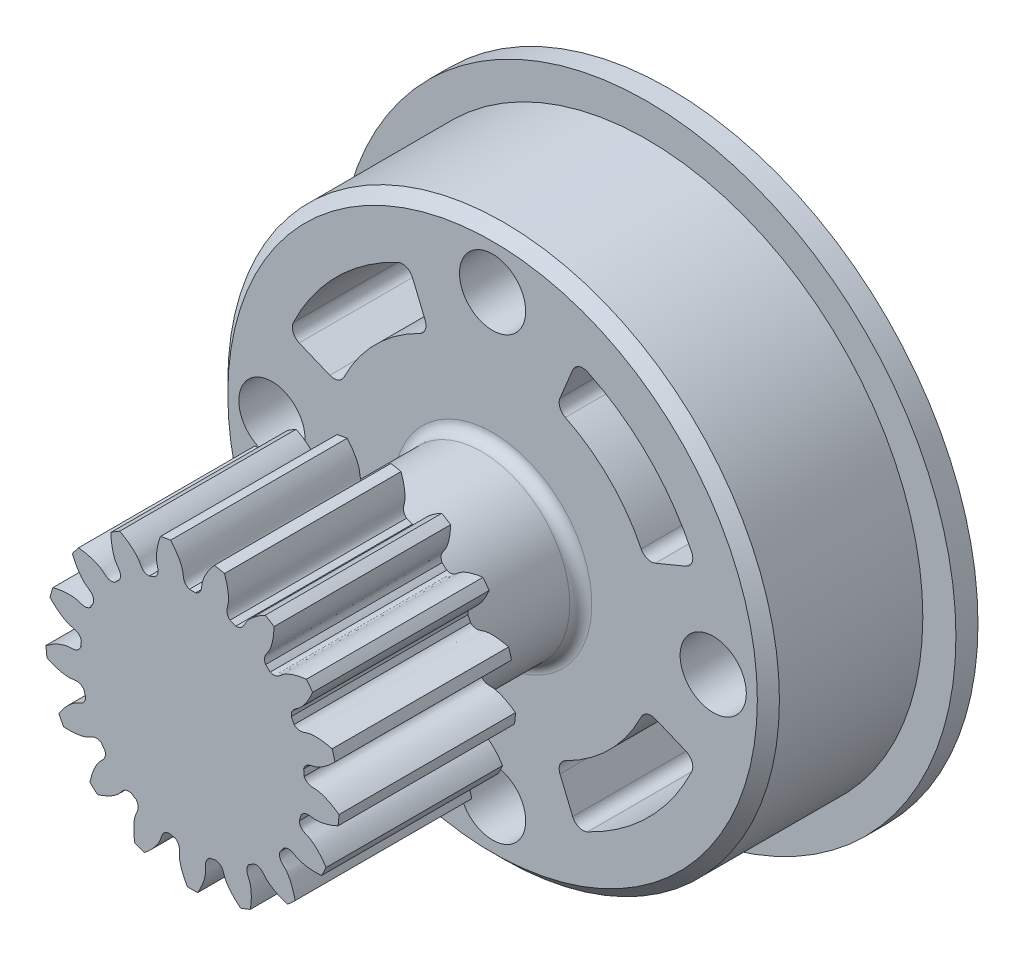
from build123d import *

# Parameters (mm, degrees)
SKETCH_1_R               = 6.65
EXTRUDE_1_DEPTH          = 8
CUT_EXTRUDE_1_DEPTH      = 13.346861949
PATTERN_CIRCULAR_1_COUNT = 17
SKETCH_6_R               = 1.5
CUT_EXTRUDE_2_DEPTH      = 25.019994448
SKETCH_7_R               = 3
CUT_EXTRUDE_3_DEPTH      = 2.5
CHAMFER_1_SIZE           = 0.5
FILLET_1_R               = 0.5
CUT_EXTRUDE_4_DEPTH      = 25.019994448
FILLET_2_R               = 0.5


with BuildPart() as part:
    # 草图1 → 凸台-拉伸1 (new body)
    with BuildSketch(Plane.XY):
        Circle(SKETCH_1_R)
    extrude(amount=EXTRUDE_1_DEPTH)

    # 草图2 → 切除-拉伸1 (cut, through all)
    with BuildSketch(Plane.XY):
        with BuildLine():
            ThreePointArc((0.141185623, 5.07303574), (0, 5.075), (-0.141185623, 5.07303574))
            add(Edge.make_bspline(
                [(-0.141185623, 5.07303574), (-0.439515818, 5.197375415), (-0.396336765, 5.428369385), (-0.446813923, 5.645376896), (-0.451483014, 5.663805416), (-0.457112952, 5.68429352), (-0.463785413, 5.706809733), (-0.471584244, 5.731319554), (-0.480591356, 5.75778613), (-0.490887912, 5.786170076), (-0.502553878, 5.816429566), (-0.515668075, 5.848520345), (-0.530308075, 5.882395764), (-0.546550149, 5.918006809), (-0.564469203, 5.955302137), (-0.584138712, 5.994228111), (-0.605630663, 6.034728836), (-0.629015489, 6.0767462), (-0.654362013, 6.12021991), (-0.681737388, 6.165087537), (-0.71120704, 6.211284558), (-0.74283461, 6.258744399), (-0.776681898, 6.307398483), (-0.812808812, 6.357176277), (-0.851273308, 6.408005337), (-0.892131347, 6.459811365), (-0.935436834, 6.512518252), (-0.981241578, 6.566048138), (-1.029595236, 6.620321463), (-1.08054527, 6.675257018), (-1.134136899, 6.730772009), (-1.190413058, 6.786782109), (-1.249414352, 6.843201518), (-1.311179015, 6.899943022), (-1.375742871, 6.956918056), (-1.443139296, 7.014036763), (-1.513399177, 7.07120806), (-1.586550883, 7.128339697), (-1.662620224, 7.185338326), (-1.741630425, 7.242109564), (-1.823602093, 7.298558063), (-1.908553174, 7.354587572), (-2.027075144, 7.429401373), (-2.118603831, 7.48336818), (-2.180952083, 7.518503383)],
                knots=[0, 0, 0, 0, 0.193882922, 0.199023975, 0.204850501, 0.211362501, 0.218559975, 0.226442923, 0.235011345, 0.24426524, 0.254204608, 0.264829451, 0.276139767, 0.288135557, 0.300816821, 0.314183558, 0.328235769, 0.342973453, 0.358396612, 0.374505244, 0.39129935, 0.408778929, 0.426943982, 0.445794509, 0.46533051, 0.485551984, 0.506458932, 0.528051354, 0.550329249, 0.573292619, 0.596941461, 0.621275778, 0.646295568, 0.672000832, 0.69839157, 0.725467781, 0.753229466, 0.781676625, 0.810809257, 0.840627364, 0.871130943, 0.902319997, 0.934194524, 1, 1, 1, 1], degree=3))
            ThreePointArc((-2.180952083, 7.518503383), (0, 7.828438229), (2.180952083, 7.518503383))
            add(Edge.make_bspline(
                [(0.141185623, 5.07303574), (0.439515818, 5.197375415), (0.396336765, 5.428369385), (0.446813923, 5.645376896), (0.451483014, 5.663805416), (0.457112952, 5.68429352), (0.463785413, 5.706809733), (0.471584244, 5.731319554), (0.480591356, 5.75778613), (0.490887912, 5.786170076), (0.502553878, 5.816429566), (0.515668075, 5.848520345), (0.530308075, 5.882395764), (0.546550149, 5.918006809), (0.564469203, 5.955302137), (0.584138712, 5.994228111), (0.605630663, 6.034728836), (0.629015489, 6.0767462), (0.654362013, 6.12021991), (0.681737388, 6.165087537), (0.71120704, 6.211284558), (0.74283461, 6.258744399), (0.776681898, 6.307398483), (0.812808812, 6.357176277), (0.851273308, 6.408005337), (0.892131347, 6.459811365), (0.935436834, 6.512518252), (0.981241578, 6.566048138), (1.029595236, 6.620321463), (1.08054527, 6.675257018), (1.134136899, 6.730772009), (1.190413058, 6.786782109), (1.249414352, 6.843201518), (1.311179015, 6.899943022), (1.375742871, 6.956918056), (1.443139296, 7.014036763), (1.513399177, 7.07120806), (1.586550883, 7.128339697), (1.662620224, 7.185338326), (1.741630425, 7.242109564), (1.823602093, 7.298558063), (1.908553174, 7.354587572), (2.027075144, 7.429401373), (2.118603831, 7.48336818), (2.180952083, 7.518503383)],
                knots=[0, 0, 0, 0, 0.193882922, 0.199023975, 0.204850501, 0.211362501, 0.218559975, 0.226442923, 0.235011345, 0.24426524, 0.254204608, 0.264829451, 0.276139767, 0.288135557, 0.300816821, 0.314183558, 0.328235769, 0.342973453, 0.358396612, 0.374505244, 0.39129935, 0.408778929, 0.426943982, 0.445794509, 0.46533051, 0.485551984, 0.506458932, 0.528051354, 0.550329249, 0.573292619, 0.596941461, 0.621275778, 0.646295568, 0.672000832, 0.69839157, 0.725467781, 0.753229466, 0.781676625, 0.810809257, 0.840627364, 0.871130943, 0.902319997, 0.934194524, 1, 1, 1, 1], degree=3))
        make_face()
    cut_extrude_1 = extrude(amount=CUT_EXTRUDE_1_DEPTH, mode=Mode.SUBTRACT)

    # 阵列(圆周)1: 切除-拉伸1 ×17 about axis
    pattern_circular_1_axis = Axis((0, 0, -11.005), (0, 0, 1))
    for i in range(1, PATTERN_CIRCULAR_1_COUNT):
        add(cut_extrude_1.rotate(pattern_circular_1_axis, i * 360 / PATTERN_CIRCULAR_1_COUNT), mode=Mode.SUBTRACT)

    # 草图5 → 旋转1 (revolve)
    with BuildSketch(Plane(origin=(0, 0, 0), x_dir=(0, 0, -1), z_dir=(1, 0, 0))):
        Polygon((0, 0), (13.6, 0), (13.6, 14), (12.6, 14), (12.6, 12.5), (5.6, 12.5), (5.6, 4), (0, 4), align=None)
    revolve(axis=Axis((0, 0, 0), (0, 0, -1)))

    # 草图6 → 切除-拉伸2 (cut, through all)
    with BuildSketch(Plane.XY.offset(-5.6)):
        with Locations((0, 10)):
            Circle(SKETCH_6_R)
        with Locations((10, 0)):
            Circle(SKETCH_6_R)
        with Locations((0, -10)):
            Circle(SKETCH_6_R)
        with Locations((-10, 0)):
            Circle(SKETCH_6_R)
    extrude(amount=-CUT_EXTRUDE_2_DEPTH, mode=Mode.SUBTRACT)

    # 草图7 → 切除-拉伸3 (cut)
    with BuildSketch(Plane(origin=(0, 0, -13.6), x_dir=(-1, 0, 0), z_dir=(0, 0, -1))):
        Circle(SKETCH_7_R)
    extrude(amount=-CUT_EXTRUDE_3_DEPTH, mode=Mode.SUBTRACT)

    # 倒角1
    chamfer_1_edges = [part.edges().sort_by_distance(p)[0] for p in [
        (0, -12.5, -5.6),
    ]]
    chamfer(chamfer_1_edges, length=CHAMFER_1_SIZE)

    # 圆角1
    fillet_1_edges = [part.edges().sort_by_distance(p)[0] for p in [
        (0, -4, 0),
        (0, -4, -5.6),
    ]]
    fillet(fillet_1_edges, radius=FILLET_1_R)

    # 草图8 → 切除-拉伸4 (cut, through all)
    with BuildSketch(Plane.XY.offset(-5.6)):
        with BuildLine():
            Line((-9.238795325, 3.826834324), (-6.929096494, 2.870125743))
            ThreePointArc((-6.929096494, 2.870125743), (-5.303300859, 5.303300859), (-2.870125743, 6.929096494))
            Line((-2.870125743, 6.929096494), (-3.826834324, 9.238795325))
            ThreePointArc((-3.826834324, 9.238795325), (-7.071067812, 7.071067812), (-9.238795325, 3.826834324))
        make_face()
        with BuildLine():
            Line((9.238795325, 3.826834324), (6.929096494, 2.870125743))
            ThreePointArc((6.929096494, 2.870125743), (5.303300859, 5.303300859), (2.870125743, 6.929096494))
            Line((2.870125743, 6.929096494), (3.826834324, 9.238795325))
            ThreePointArc((3.826834324, 9.238795325), (7.071067812, 7.071067812), (9.238795325, 3.826834324))
        make_face()
        with BuildLine():
            Line((3.826834324, -9.238795325), (2.870125743, -6.929096494))
            ThreePointArc((2.870125743, -6.929096494), (5.303300859, -5.303300859), (6.929096494, -2.870125743))
            Line((6.929096494, -2.870125743), (9.238795325, -3.826834324))
            ThreePointArc((9.238795325, -3.826834324), (7.071067812, -7.071067812), (3.826834324, -9.238795325))
        make_face()
        with BuildLine():
            Line((-9.238795325, -3.826834324), (-6.929096494, -2.870125743))
            ThreePointArc((-6.929096494, -2.870125743), (-5.303300859, -5.303300859), (-2.870125743, -6.929096494))
            Line((-2.870125743, -6.929096494), (-3.826834324, -9.238795325))
            ThreePointArc((-3.826834324, -9.238795325), (-7.071067812, -7.071067812), (-9.238795325, -3.826834324))
        make_face()
    extrude(amount=-CUT_EXTRUDE_4_DEPTH, mode=Mode.SUBTRACT)

    # 圆角2
    fillet_2_edges = [part.edges().sort_by_distance(p)[0] for p in [
        (-9.238795325, 3.826834324, -9.6),
        (-2.870125743, 6.929096494, -9.6),
        (-6.929096494, 2.870125743, -9.6),
        (3.826834324, 9.238795325, -9.6),
        (9.238795325, 3.826834324, -9.6),
        (6.929096494, 2.870125743, -9.6),
        (2.870125743, 6.929096494, -9.6),
        (9.238795325, -3.826834324, -9.6),
        (3.826834324, -9.238795325, -9.6),
        (2.870125743, -6.929096494, -9.6),
        (6.929096494, -2.870125743, -9.6),
        (-3.826834324, -9.238795325, -9.6),
        (-9.238795325, -3.826834324, -9.6),
        (-6.929096494, -2.870125743, -9.6),
        (-2.870125743, -6.929096494, -9.6),
        (-3.826834324, 9.238795325, -9.6),
    ]]
    fillet(fillet_2_edges, radius=FILLET_2_R)


solid = part.part
